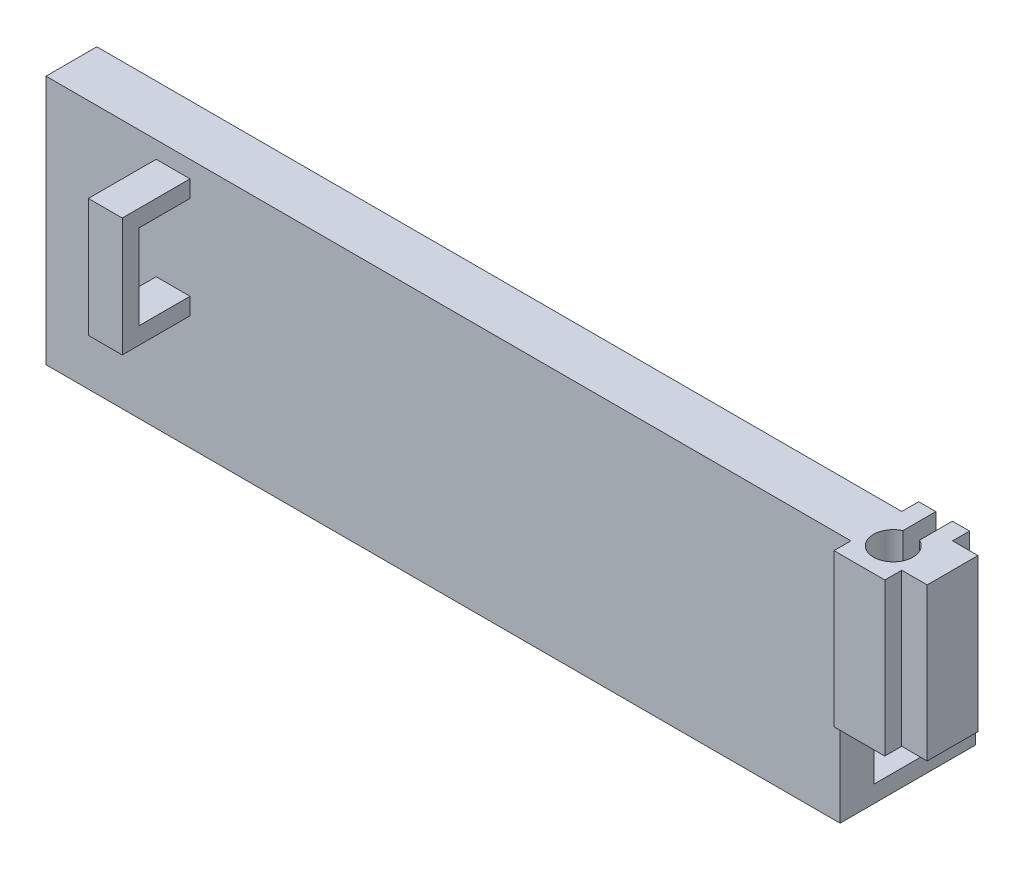
from build123d import *

# Parameters (mm, degrees)
SKETCH2_W            = 53
SKETCH2_H            = 9
BOSS_EXTRUDE1_DEPTH  = 3
SKETCH11_W           = 2
SKETCH11_H           = 9
CUT_EXTRUDE3_DEPTH   = 5
SKETCH12_W           = 3
SKETCH12_H           = 9
BOSS_EXTRUDE7_DEPTH  = 1
SKETCH13_W           = 1
SKETCH13_H           = 1
BOSS_EXTRUDE8_DEPTH  = 4
SKETCH14_W           = 1
SKETCH14_H           = 1
BOSS_EXTRUDE9_DEPTH  = 5
SKETCH15_W           = 45.862173985
SKETCH15_H           = 3
BOSS_EXTRUDE10_DEPTH = 1.5
SKETCH25_W           = 3
SKETCH25_H           = 9
BOSS_EXTRUDE13_DEPTH = 1
SKETCH24_R           = 1.16794594
CUT_EXTRUDE7_DEPTH   = 9
SKETCH26_W           = 0.9784551
SKETCH26_H           = 1.939455742
CUT_EXTRUDE8_DEPTH   = 9
SKETCH27_W           = 45.862173985
SKETCH27_H           = 3
BOSS_EXTRUDE14_DEPTH = 2
SKETCH28_W           = 41.224865511
SKETCH28_H           = 1
CUT_EXTRUDE9_DEPTH   = 1.5
SKETCH29_W           = 3
SKETCH29_H           = 12.5
BOSS_EXTRUDE15_DEPTH = 1
BOSS_EXTRUDE16_DEPTH = 1
SKETCH31_W           = 2.328454802
SKETCH31_H           = 1
CUT_EXTRUDE10_DEPTH  = 1.5
BOSS_EXTRUDE17_DEPTH = 2
BOSS_EXTRUDE18_REACH = 53.942
SKETCH34_W           = 46.86
SKETCH34_H           = 1.5
SKETCH35_W           = 43.553320313
SKETCH35_H           = 1.25
CUT_EXTRUDE11_DEPTH  = 1
CUT_EXTRUDE12_REACH  = 54.259
SKETCH36_W           = 46.86
SKETCH36_H           = 3.75
SKETCH37_W           = 2
SKETCH37_H           = 2.25
CUT_EXTRUDE13_DEPTH  = 10
BOSS_EXTRUDE19_DEPTH = 2.5
SKETCH42_W           = 43.553320313
SKETCH42_H           = 1
BOSS_EXTRUDE20_DEPTH = 1
SKETCH44_W           = 46.862173985
SKETCH44_H           = 1
BOSS_EXTRUDE21_DEPTH = 5
SKETCH46_W           = 43.553320313
SKETCH46_H           = 1
BOSS_EXTRUDE22_DEPTH = 1


with BuildPart() as part:
    # Sketch2 → Boss-Extrude1 (new body)
    with BuildSketch(Plane.XY):
        with Locations((26.5, 4.5)):
            Rectangle(SKETCH2_W, SKETCH2_H)
    extrude(amount=BOSS_EXTRUDE1_DEPTH)

    # Sketch11 → Cut-Extrude3 (cut)
    with BuildSketch(Plane.XY.offset(3)):
        with Locations((52, 4.5)):
            Rectangle(SKETCH11_W, SKETCH11_H)
    extrude(amount=-CUT_EXTRUDE3_DEPTH, mode=Mode.SUBTRACT)

    # Sketch12 → Boss-Extrude7 (add)
    with BuildSketch(Plane.XY.offset(3)):
        with Locations((48, 4.5)):
            Rectangle(SKETCH12_W, SKETCH12_H)
    extrude(amount=BOSS_EXTRUDE7_DEPTH)

    # Sketch13 → Boss-Extrude8 (add)
    with BuildSketch(Plane.XY.offset(3)):
        with Locations((7, 7.5)):
            Rectangle(SKETCH13_W, SKETCH13_H)
        with Locations((7, 1.5)):
            Rectangle(SKETCH13_W, SKETCH13_H)
    extrude(amount=BOSS_EXTRUDE8_DEPTH)

    # Sketch14 → Boss-Extrude9 (add)
    with BuildSketch(Plane.XZ.offset(-7)):
        with Locations((7, 6.5)):
            Rectangle(SKETCH14_W, SKETCH14_H)
    extrude(amount=BOSS_EXTRUDE9_DEPTH)

    # Sketch15 → Boss-Extrude10 (add)
    with BuildSketch(Plane.XZ):
        with Locations((22.931086993, 1.5)):
            Rectangle(SKETCH15_W, SKETCH15_H)
    extrude(amount=BOSS_EXTRUDE10_DEPTH)

    # Sketch25 → Boss-Extrude13 (add)
    with BuildSketch(Plane(origin=(0, 0, 0), x_dir=(-1, 0, 0), z_dir=(0, 0, -1))):
        with Locations((-48, 4.5)):
            Rectangle(SKETCH25_W, SKETCH25_H)
    extrude(amount=BOSS_EXTRUDE13_DEPTH)

    # Sketch24 → Cut-Extrude7 (cut)
    with BuildSketch(Plane(origin=(0, 9, 0), x_dir=(1, 0, 0), z_dir=(0, 1, 0))):
        with Locations(Location((48, -2, 0), (0, 0, 270))):
            Circle(SKETCH24_R)
    extrude(amount=-CUT_EXTRUDE7_DEPTH, mode=Mode.SUBTRACT)

    # Sketch26 → Cut-Extrude8 (cut)
    with BuildSketch(Plane(origin=(0, 9, 0), x_dir=(1, 0, 0), z_dir=(0, 1, 0))):
        with Locations((48, 0.030272129)):
            Rectangle(SKETCH26_W, SKETCH26_H)
    extrude(amount=-CUT_EXTRUDE8_DEPTH, mode=Mode.SUBTRACT)

    # Sketch27 → Boss-Extrude14 (add)
    with BuildSketch(Plane.XZ.offset(1.5)):
        with Locations((22.931086993, 1.5)):
            Rectangle(SKETCH27_W, SKETCH27_H)
    extrude(amount=BOSS_EXTRUDE14_DEPTH)

    # Sketch28 → Cut-Extrude9 (cut)
    with BuildSketch(Plane.XZ.offset(3.5)):
        with Locations((22.921286428, 0.5)):
            Rectangle(SKETCH28_W, SKETCH28_H)
    extrude(amount=-CUT_EXTRUDE9_DEPTH, mode=Mode.SUBTRACT)

    # Sketch29 → Boss-Extrude15 (add)
    with BuildSketch(Plane.ZY):
        with Locations((1.5, 2.75)):
            Rectangle(SKETCH29_W, SKETCH29_H)
    extrude(amount=BOSS_EXTRUDE15_DEPTH)

    # Sketch30 → Boss-Extrude16 (add)
    with BuildSketch(Plane.ZY.offset(-6.5)):
        Polygon((3, 8), (3, 7), (6, 7), (6, 2), (3, 2), (3, 1), (7, 1), (7, 8), align=None)
    extrude(amount=BOSS_EXTRUDE16_DEPTH)

    # Sketch31 → Cut-Extrude10 (cut)
    with BuildSketch(Plane.XZ.offset(3.5)):
        with Locations((44.697946584, 0.5)):
            Rectangle(SKETCH31_W, SKETCH31_H)
    extrude(amount=-CUT_EXTRUDE10_DEPTH, mode=Mode.SUBTRACT)

    # Sketch32 → Boss-Extrude17 (add)
    with BuildSketch(Plane.XZ.offset(3.5)):
        Polygon((-1, 3), (-1, 0), (2.308853672, 0), (2.308853672, 1), (45.862173985, 1), (45.862173985, 3), align=None)
    extrude(amount=BOSS_EXTRUDE17_DEPTH)

    # Boss-Extrude18: up to this face of the body (flat: up to its plane)
    boss_extrude18_end = Plane(part.part.faces().sort_by_distance((22.213634354, 3.353188918, 0))[0])
    # Sketch34 → Boss-Extrude18 (add, up to the picked face)
    with BuildSketch(Plane.XY.offset(3), mode=Mode.PRIVATE) as boss_extrude18_sk1:
        with Locations((22.43, -6.25)):
            Rectangle(SKETCH34_W, SKETCH34_H)
    boss_extrude18_tool1 = split(extrude(boss_extrude18_sk1.sketch, amount=-BOSS_EXTRUDE18_REACH, mode=Mode.PRIVATE), bisect_by=boss_extrude18_end, keep=Keep.BOTH, mode=Mode.PRIVATE)
    add(boss_extrude18_tool1.solids().sort_by(Axis((22.43, -6.25, 3), (0, 0, -1)))[0])

    # Sketch35 → Cut-Extrude11 (cut)
    with BuildSketch(Plane(origin=(0, 0, 0), x_dir=(-1, 0, 0), z_dir=(0, 0, -1))):
        with Locations((-24.085513829, -1.375)):
            Rectangle(SKETCH35_W, SKETCH35_H)
    extrude(amount=-CUT_EXTRUDE11_DEPTH, mode=Mode.SUBTRACT)

    # Cut-Extrude12: up to this face of the body (flat: up to its plane)
    cut_extrude12_end = Plane(part.part.faces().sort_by_distance((50.25, 4.5, 3))[0])
    # Sketch36 → Cut-Extrude12 (cut, up to the picked face)
    with BuildSketch(Plane(origin=(0, 0, 0), x_dir=(-1, 0, 0), z_dir=(0, 0, -1)), mode=Mode.PRIVATE) as cut_extrude12_sk1:
        with Locations((-22.43, -5.125)):
            Rectangle(SKETCH36_W, SKETCH36_H)
    cut_extrude12_tool1 = split(extrude(cut_extrude12_sk1.sketch, amount=-CUT_EXTRUDE12_REACH, mode=Mode.PRIVATE), bisect_by=cut_extrude12_end, keep=Keep.BOTH, mode=Mode.PRIVATE)
    add(cut_extrude12_tool1.solids().sort_by(Axis((22.43, -5.125, 0), (0, 0, 1)))[0], mode=Mode.SUBTRACT)

    # Sketch37 → Cut-Extrude13 (cut)
    with BuildSketch(Plane.ZY.offset(-45.86)):
        with Locations((2, -4.375)):
            Rectangle(SKETCH37_W, SKETCH37_H)
    extrude(amount=-CUT_EXTRUDE13_DEPTH, mode=Mode.SUBTRACT)

    # Sketch41 → Boss-Extrude19 (add)
    with BuildSketch(Plane.XZ.offset(3.25)):
        Polygon((-1, 0), (-1, 3), (45.862173985, 3), (45.862173985, 1), (2.308853672, 1), (2.308853672, 0), align=None)
    extrude(amount=BOSS_EXTRUDE19_DEPTH)

    # Sketch42 → Boss-Extrude20 (add)
    with BuildSketch(Plane(origin=(0, 0, 1), x_dir=(-1, 0, 0), z_dir=(0, 0, -1))):
        with Locations((-24.085513829, -5.25)):
            Rectangle(SKETCH42_W, SKETCH42_H)
    extrude(amount=BOSS_EXTRUDE20_DEPTH)

    # Sketch44 → Boss-Extrude21 (add)
    with BuildSketch(Plane(origin=(0, 0, 0), x_dir=(-1, 0, 0), z_dir=(0, 0, -1))):
        with Locations((-22.431086993, -5.25)):
            Rectangle(SKETCH44_W, SKETCH44_H)
    extrude(amount=BOSS_EXTRUDE21_DEPTH)

    # Sketch46 → Boss-Extrude22 (add)
    with BuildSketch(Plane.XZ.offset(0.75)):
        with Locations((24.085513829, 0.5)):
            Rectangle(SKETCH46_W, SKETCH46_H)
    extrude(amount=BOSS_EXTRUDE22_DEPTH)


solid = part.part
